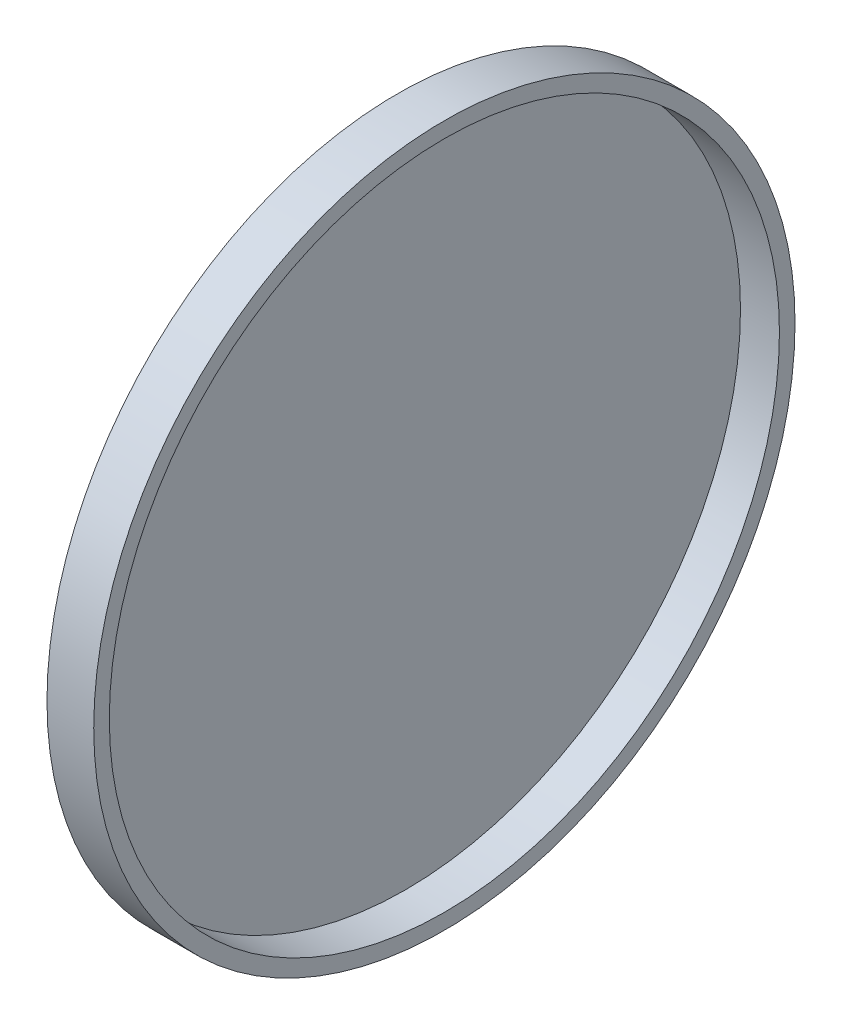
from build123d import *

# Parameters (mm, degrees)
SKETCH1_R           = 45
SKETCH1_R_2         = 43
BOSS_EXTRUDE1_DEPTH = 5
BOSS_EXTRUDE2_START = 1
SKETCH2_R           = 45
BOSS_EXTRUDE2_DEPTH = 1


with BuildPart() as part:
    # Sketch1 → Boss-Extrude1 (new body)
    with BuildSketch(Plane(origin=(0, 0, 0), x_dir=(0, 0, -1), z_dir=(1, 0, 0))):
        Circle(SKETCH1_R)
        Circle(SKETCH1_R_2, mode=Mode.SUBTRACT)
    extrude(amount=BOSS_EXTRUDE1_DEPTH)

    # Sketch2 → Boss-Extrude2 (add)
    with BuildSketch(Plane.ZY.offset(BOSS_EXTRUDE2_START)):
        Circle(SKETCH2_R)
    extrude(amount=-BOSS_EXTRUDE2_DEPTH)


solid = part.part
